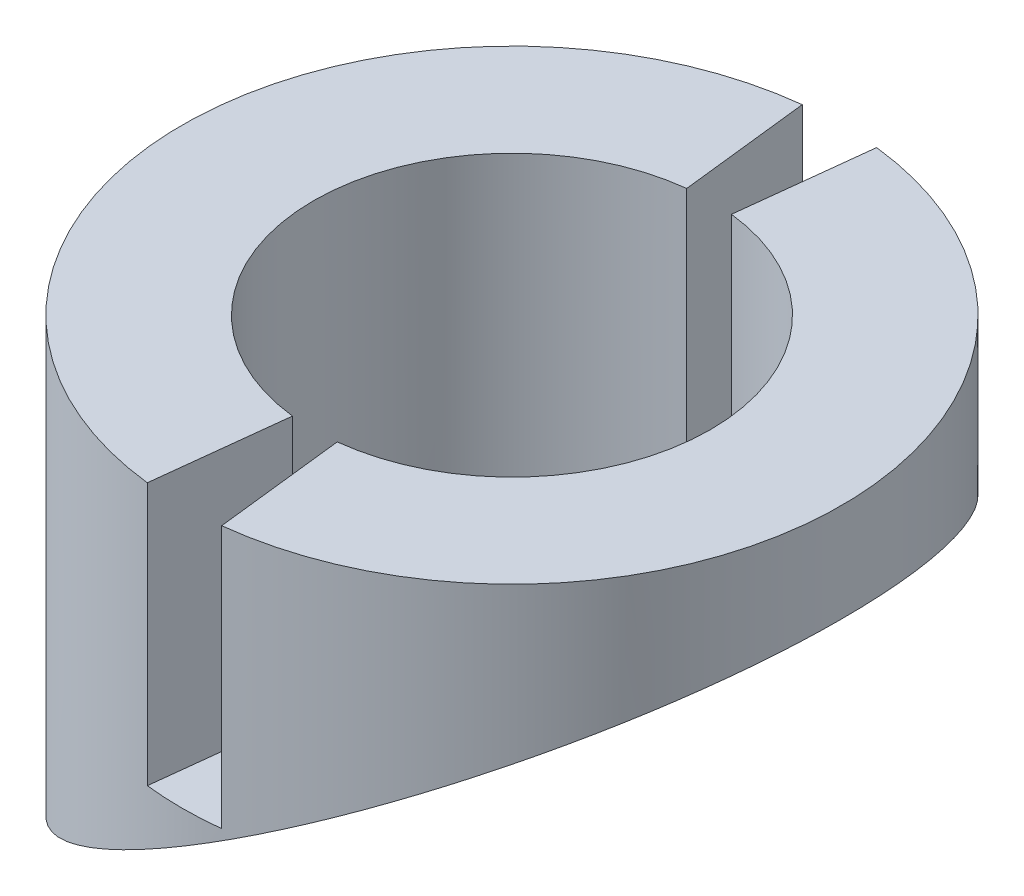
from build123d import *

# Parameters (mm, degrees)
SKETCH1_R           = 10.05
SKETCH1_R_2         = 6.05
BOSS_EXTRUDE1_DEPTH = 15
CUT_EXTRUDE2_DEPTH  = 8
CUT_EXTRUDE3_DEPTH  = 15


with BuildPart() as part:
    # Sketch1 → Boss-Extrude1 (new body)
    with BuildSketch(Plane(origin=(0, 0, 0), x_dir=(1, 0, 0), z_dir=(0, 1, 0))):
        with Locations(Location((0, 0, 0), (0, 0, 270))):
            Circle(SKETCH1_R)
        with Locations(Location((0, 0, 0), (0, 0, 270))):
            Circle(SKETCH1_R_2, mode=Mode.SUBTRACT)
    extrude(amount=BOSS_EXTRUDE1_DEPTH)

    # Sketch6 → Cut-Extrude2 (cut)
    with BuildSketch(Plane(origin=(0, 15, 0), x_dir=(1, 0, 0), z_dir=(0, 1, 0))):
        Polygon((-0.637272671, 5.61077026), (0.637272671, 5.61077026), (1.215708589, 10.703521268), (-1.215708589, 10.703521268), align=None)
        Polygon((-0.637272671, -5.61077026), (-1.215708589, -10.703521268), (1.215708589, -10.703521268), (0.637272671, -5.61077026), align=None)
    extrude(amount=-CUT_EXTRUDE2_DEPTH, mode=Mode.SUBTRACT)

    # Sketch3 → Cut-Extrude3 (cut, symmetric)
    with BuildSketch(Plane.XY):
        Polygon((-10.05, 0), (10.05, 12), (10.05, 0), align=None)
    extrude(amount=CUT_EXTRUDE3_DEPTH, both=True, mode=Mode.SUBTRACT)


solid = part.part
